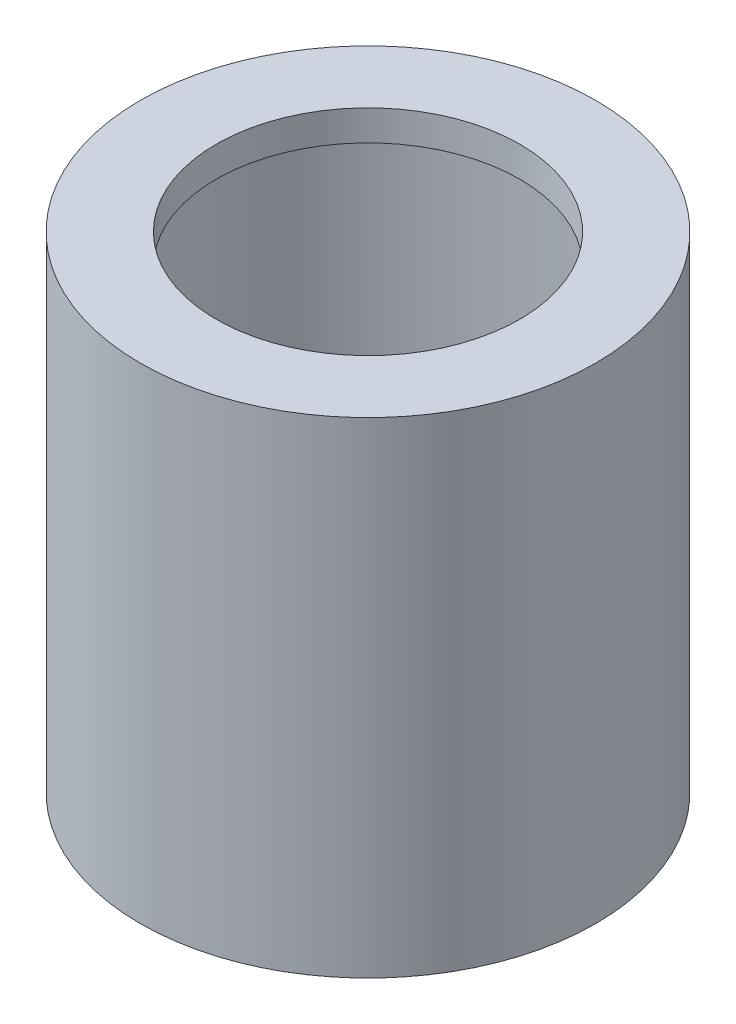
from build123d import *


with BuildPart() as part:
    # Sketch1 → Revolve1 (revolve)
    with BuildSketch(Plane.XY, mode=Mode.PRIVATE) as revolve1_sk:
        Polygon((-11.90625, 25.387594627), (-11.90625, 0), (-11.1125, 0), (-11.1125, 23.800094627), (-7.9375, 23.800094627), (-7.9375, 25.387594627), align=None)
    revolve(revolve1_sk.sketch.rotate(Axis((0, 0, 0), (0, 1, 0)), 270), axis=Axis((0, 0, 0), (0, 1, 0)))


solid = part.part
